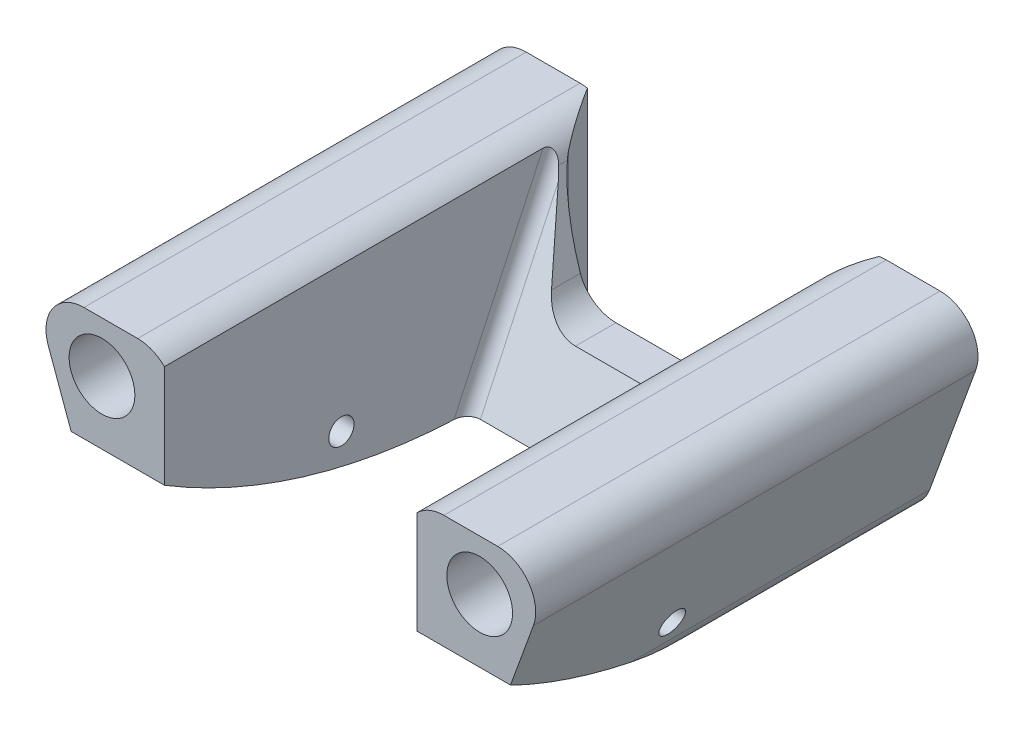
from build123d import *

# Parameters (mm, degrees)
SKETCH1_R               = 2.6
BOSS_EXTRUDE1_DEPTH     = 35
CUT_EXTRUDE3_DEPTH      = 10
CUT_EXTRUDE4_DEPTH      = 67.997971518
CUT_EXTRUDE4_DEPTH_BACK = 67.997971518
SKETCH5_R               = 1
CUT_EXTRUDE5_DEPTH      = 44.084608481
FILLET1_R               = 3
CUT_EXTRUDE6_DEPTH      = 67.997971643
CUT_EXTRUDE6_DEPTH_BACK = 67.997971643
FILLET2_R               = 1


with BuildPart() as part:
    # Sketch1 → Boss-Extrude1 (new body)
    with BuildSketch(Plane.XY):
        with BuildLine():
            Line((-19.191312838, -37.02606043), (-15.551610496, -47.02606043))
            ThreePointArc((-15.551610496, -47.02606043), (-14.453261942, -48.457456133), (-12.732532633, -49))
            Line((-12.732532633, -49), (12.732532633, -49))
            ThreePointArc((12.732532633, -49), (14.453261942, -48.457456133), (15.551610496, -47.02606043))
            Line((15.551610496, -47.02606043), (19.191312838, -37.02606043))
            ThreePointArc((19.191312838, -37.02606043), (18.829691109, -34.279270691), (16.372234976, -33))
            Line((16.372234976, -33), (12.115523886, -33))
            ThreePointArc((12.115523886, -33), (10.394794577, -33.542543867), (9.296446024, -34.97393957))
            Line((9.296446024, -34.97393957), (7.093654177, -41.02606043))
            ThreePointArc((7.093654177, -41.02606043), (5.995305623, -42.457456133), (4.274576314, -43))
            Line((4.274576314, -43), (-4.274576314, -43))
            ThreePointArc((-4.274576314, -43), (-5.995305623, -42.457456133), (-7.093654177, -41.02606043))
            Line((-7.093654177, -41.02606043), (-9.296446024, -34.97393957))
            ThreePointArc((-9.296446024, -34.97393957), (-10.394794577, -33.542543867), (-12.115523886, -33))
            Line((-12.115523886, -33), (-16.372234976, -33))
            ThreePointArc((-16.372234976, -33), (-18.829691109, -34.279270691), (-19.191312838, -37.02606043))
        make_face()
        with Locations(Location((-14.944086969, -37, 0), (0, 0, 180))):
            Circle(SKETCH1_R, mode=Mode.SUBTRACT)
        with Locations(Location((14.944086969, -37, 0), (0, 0, 180))):
            Circle(SKETCH1_R, mode=Mode.SUBTRACT)
    extrude(amount=BOSS_EXTRUDE1_DEPTH)

    # Sketch4 → Cut-Extrude3 (cut, symmetric)
    with BuildSketch(Plane(origin=(0, 0, 0), x_dir=(0, 0, -1), z_dir=(1, 0, 0))):
        Polygon((-35, -49), (-11, -49), (-3.53907747, -33), (-35, -33), align=None)
    extrude(amount=CUT_EXTRUDE3_DEPTH, both=True, mode=Mode.SUBTRACT)

    # Sketch5 → Cut-Extrude4 (cut, two sides: drawn at the far end of the back side and taken through both)
    with BuildSketch(Plane.ZY.offset(-10).offset(-CUT_EXTRUDE4_DEPTH_BACK)):
        with Locations((21, -45.3)):
            Circle(SKETCH5_R)
    extrude(amount=CUT_EXTRUDE4_DEPTH + CUT_EXTRUDE4_DEPTH_BACK, mode=Mode.SUBTRACT)

    # Sketch6 → Cut-Extrude5 (cut, through all)
    with BuildSketch(Plane.XZ.offset(49)):
        Polygon((-11.532532633, 0), (11.532532633, 0), (8.645781287, 5), (-8.645781287, 5), align=None)
    extrude(amount=-CUT_EXTRUDE5_DEPTH, mode=Mode.SUBTRACT)

    # Fillet1
    fillet1_edges = [part.edges().sort_by_distance(p)[0] for p in [
        (-8.645781287, -42.88081312, 5),
        (8.645781287, -42.88081312, 5),
    ]]
    fillet(fillet1_edges, radius=FILLET1_R)

    # Sketch7 → Cut-Extrude6 (cut, two sides: drawn at the far end of the back side and taken through both)
    with BuildSketch(Plane.ZY.offset(-10).offset(-CUT_EXTRUDE6_DEPTH_BACK)):
        with BuildLine():
            Line((35, -42), (35, -49))
            Line((35, -49), (10, -49))
            ThreePointArc((10, -49), (22.980754986, -47.216982092), (35, -42))
        make_face()
    extrude(amount=CUT_EXTRUDE6_DEPTH + CUT_EXTRUDE6_DEPTH_BACK, mode=Mode.SUBTRACT)

    # Fillet2
    fillet2_edges = [part.edges().sort_by_distance(p)[0] for p in [
        (-10, -41.431305772, 7.470659919),
        (10, -41.431305772, 7.470659919),
    ]]
    fillet(fillet2_edges, radius=FILLET2_R)


solid = part.part
